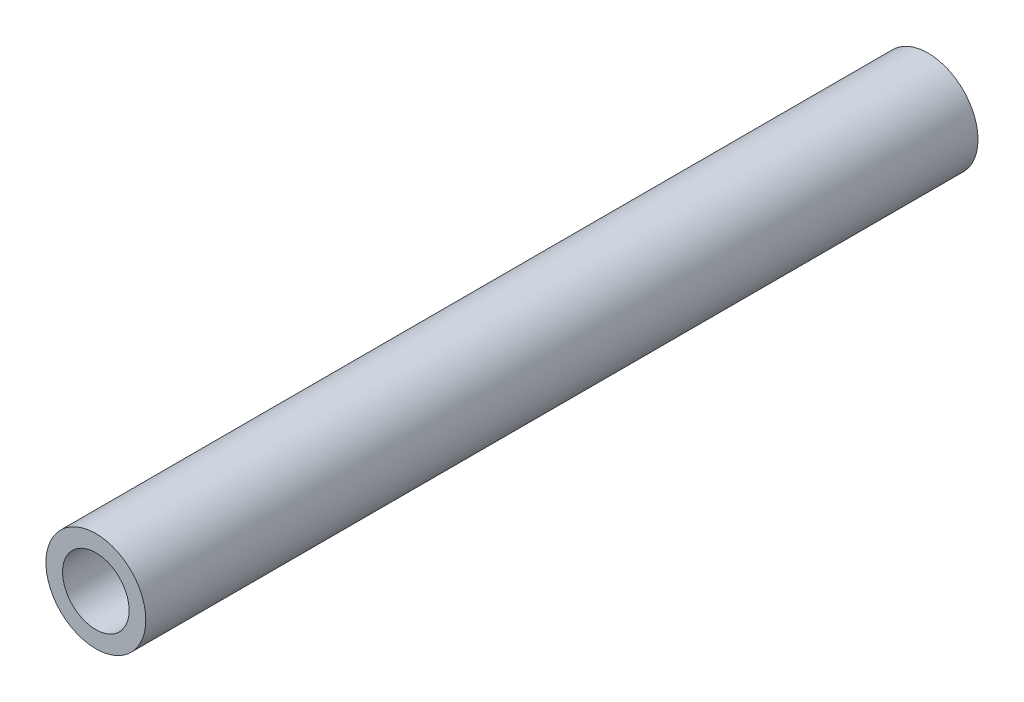
from build123d import *

# Parameters (mm, degrees)
ESQUISSE1_R             = 3
BOSS_EXTRU_1_DEPTH      = 50
ESQUISSE2_R             = 2
ENL_V_MAT_EXTRU_1_DEPTH = 51.179677161


with BuildPart() as part:
    # Esquisse1 → Boss.-Extru.1 (new body)
    with BuildSketch(Plane.XY):
        Circle(ESQUISSE1_R)
    extrude(amount=BOSS_EXTRU_1_DEPTH)

    # Esquisse2 → Enlèv. mat.-Extru.1 (cut, through all)
    with BuildSketch(Plane(origin=(0, 0, 0), x_dir=(-1, 0, 0), z_dir=(0, 0, -1))):
        Circle(ESQUISSE2_R)
    extrude(amount=-ENL_V_MAT_EXTRU_1_DEPTH, mode=Mode.SUBTRACT)


solid = part.part
